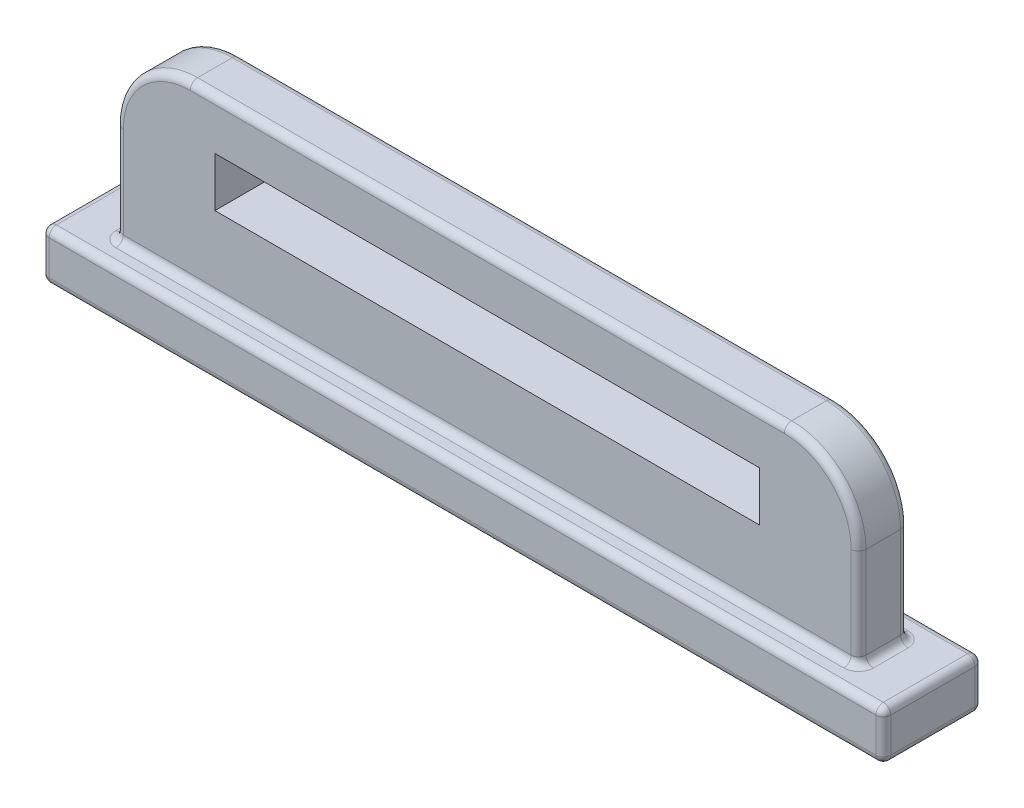
from build123d import *

# Parameters (mm, degrees)
SKETCH1_W           = 220
SKETCH1_H           = 20
BOSS_EXTRUDE1_DEPTH = 10
SKETCH2_W           = 340
SKETCH2_H           = 40
BOSS_EXTRUDE2_DEPTH = 20
FILLET1_R           = 3


with BuildPart() as part:
    # Sketch1 → Boss-Extrude1 (new, symmetric)
    with BuildSketch(Plane.XY):
        with BuildLine():
            Line((-150, -35), (150, -35))
            Line((150, -35), (150, 5))
            ThreePointArc((150, 5), (141.213203436, 26.213203436), (120, 35))
            Line((120, 35), (-120, 35))
            ThreePointArc((-120, 35), (-141.213203436, 26.213203436), (-150, 5))
            Line((-150, 5), (-150, -35))
        make_face()
        with Locations((0, 5)):
            Rectangle(SKETCH1_W, SKETCH1_H, mode=Mode.SUBTRACT)
    extrude(amount=BOSS_EXTRUDE1_DEPTH, both=True)

    # Sketch2 → Boss-Extrude2 (add)
    with BuildSketch(Plane.XZ.offset(35)):
        Rectangle(SKETCH2_W, SKETCH2_H)
    extrude(amount=BOSS_EXTRUDE2_DEPTH)

    # Fillet1
    fillet1_edges = [part.edges().sort_by_distance(p)[0] for p in [
        (150, -35, 0),
        (-150, -35, 0),
        (150, -15, 10),
        (141.213203436, 26.213203436, 10),
        (0, 35, 10),
        (-141.213203436, 26.213203436, 10),
        (170, -35, 0),
        (170, -45, -20),
        (0, -35, 20),
        (170, -45, 20),
        (-170, -35, 0),
        (-170, -45, 20),
        (0, -35, -20),
        (-170, -45, -20),
        (170, -55, 0),
        (0, -55, 20),
        (-170, -55, 0),
        (0, -55, -20),
        (-150, -15, 10),
        (-141.213203436, 26.213203436, -10),
        (0, 35, -10),
        (141.213203436, 26.213203436, -10),
        (150, -15, -10),
        (0, -35, -10),
        (-150, -15, -10),
        (0, -35, 10),
    ]]
    fillet(fillet1_edges, radius=FILLET1_R)


solid = part.part
